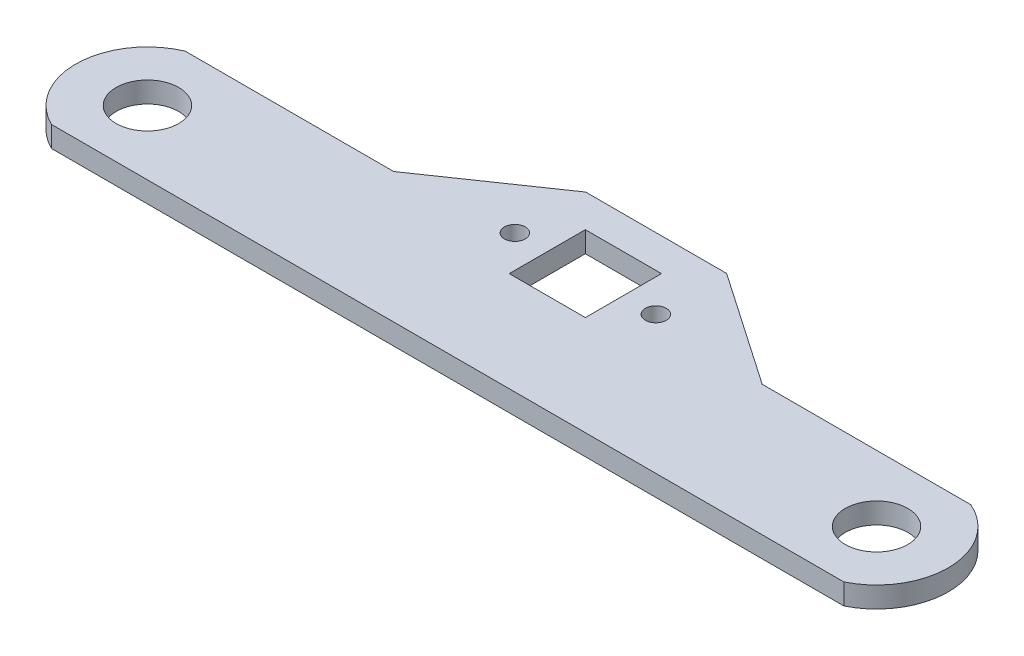
from build123d import *

# Parameters (mm, degrees)
SKETCH1_R           = 1.27
SKETCH1_R_2         = 3.81
SKETCH1_W           = 9.271
SKETCH1_H           = 9.271
BOSS_EXTRUDE1_DEPTH = 2.54


with BuildPart() as part:
    # Sketch1 → Boss-Extrude1 (new body)
    with BuildSketch(Plane(origin=(0, 0, 0), x_dir=(1, 0, 0), z_dir=(0, 1, 0))):
        with BuildLine():
            Line((48.26, 0), (-48.26, 0))
            ThreePointArc((-48.26, 0), (-53.138298297, 8.070705976), (-47.844237094, 15.875))
            Line((-47.844237094, 15.875), (-22.444237094, 15.875))
            Line((-22.444237094, 15.875), (-8.5852, 25.4))
            Line((-8.5852, 25.4), (8.5852, 25.4))
            Line((8.5852, 25.4), (22.444237094, 15.875))
            Line((22.444237094, 15.875), (47.844237094, 15.875))
            ThreePointArc((47.844237094, 15.875), (53.138298297, 8.070705976), (48.26, 0))
        make_face()
        with Locations(Location((-8.5852, 16.7767, 0), (0, 0, 270))):
            Circle(SKETCH1_R, mode=Mode.SUBTRACT)
        with Locations(Location((8.5852, 16.7767, 0), (0, 0, 90))):
            Circle(SKETCH1_R, mode=Mode.SUBTRACT)
        with Locations(Location((-44.401571021, 7.841892929, 0), (0, 0, 270))):
            Circle(SKETCH1_R_2, mode=Mode.SUBTRACT)
        with Locations(Location((44.401571021, 7.841892929, 0), (0, 0, 90))):
            Circle(SKETCH1_R_2, mode=Mode.SUBTRACT)
        with Locations((0, 16.7767)):
            Rectangle(SKETCH1_W, SKETCH1_H, mode=Mode.SUBTRACT)
    extrude(amount=BOSS_EXTRUDE1_DEPTH)


solid = part.part
